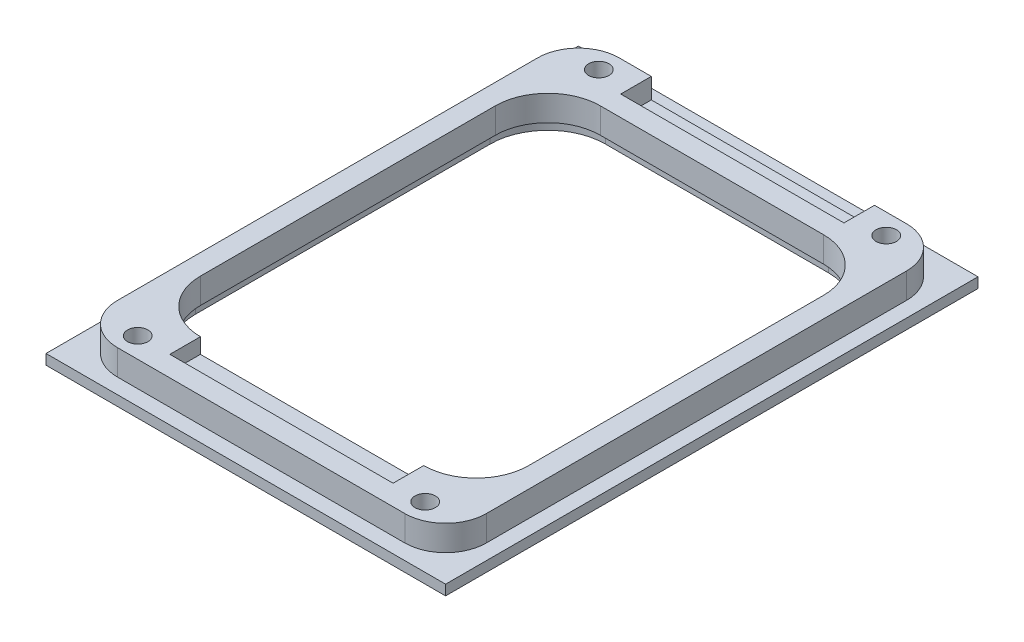
from build123d import *

# Parameters (mm, degrees)
EXTRUDE_1_DEPTH       = 2.5
SKETCH_1_3_W          = 21.9
SKETCH_1_3_H          = 3
EXTRUDE_2_DEPTH       = 0.5
SKETCH_2_R            = 1
CUT_EXTRUDE_1_DEPTH   = 34.660057049
SKETCH_3_W            = 21.9
SKETCH_3_H            = 3
CUT_EXTRUDE_2_DEPTH   = 1.5
SKETCH_4_W            = 39.2
SKETCH_4_H            = 52.23
EXTRUDE_3_DEPTH       = 1
CUT_EXTRUDE_START     = -1
CUT_EXTRUDE_3_DEPTH   = 1
FILLET_1_R            = 4
CUT_EXTRUDE_1_2_DEPTH = 1


with BuildPart() as part:
    # 草图1 → 凸台-拉伸1 (new body)
    with BuildSketch(Plane(origin=(0, 0, 0), x_dir=(1, 0, 0), z_dir=(0, 1, 0))):
        Polygon((20.308319986, -22.503204833), (20.308319986, 26.726795167), (13.158319986, 26.726795167), (13.158319986, 23.726795167), (-8.741680014, 23.726795167), (-8.741680014, 26.726795167), (-15.891680014, 26.726795167), (-15.891680014, -22.503204833), align=None)
        with BuildLine():
            ThreePointArc((18.308319986, -12.353204833), (16.799919909, -15.994804756), (13.158319986, -17.503204833))
            Line((13.158319986, -17.503204833), (-8.741680014, -17.503204833))
            ThreePointArc((-8.741680014, -17.503204833), (-12.383279937, -15.994804756), (-13.891680014, -12.353204833))
            Line((-13.891680014, -12.353204833), (-13.891680014, 16.576795167))
            ThreePointArc((-13.891680014, 16.576795167), (-12.383279937, 20.21839509), (-8.741680014, 21.726795167))
            Line((-8.741680014, 21.726795167), (13.158319986, 21.726795167))
            ThreePointArc((13.158319986, 21.726795167), (16.799919909, 20.21839509), (18.308319986, 16.576795167))
            Line((18.308319986, 16.576795167), (18.308319986, -12.353204833))
        make_face(mode=Mode.SUBTRACT)
    extrude(amount=EXTRUDE_1_DEPTH)

    # 草图1<3> → 凸台-拉伸2 (add)
    with BuildSketch(Plane(origin=(0, 0, 0), x_dir=(1, 0, 0), z_dir=(0, 1, 0))):
        with Locations((2.208319986, 25.226795167)):
            Rectangle(SKETCH_1_3_W, SKETCH_1_3_H)
    extrude(amount=EXTRUDE_2_DEPTH)

    # 草图2 → Cut-Extrude 1 (cut, through all)
    with BuildSketch(Plane.XZ):
        with Locations((-11.891680014, -24.726795167)):
            Circle(SKETCH_2_R)
        with Locations((-11.891680014, 20.503204833)):
            Circle(SKETCH_2_R)
        with Locations((16.308319986, 20.503204833)):
            Circle(SKETCH_2_R)
        with Locations((16.308319986, -24.726795167)):
            Circle(SKETCH_2_R)
    extrude(amount=-CUT_EXTRUDE_1_DEPTH, mode=Mode.SUBTRACT)

    # 草图3 → 切除-拉伸2 (cut)
    with BuildSketch(Plane(origin=(0, 2.5, 0), x_dir=(1, 0, 0), z_dir=(0, 1, 0))):
        with Locations((2.208319986, -19.003204833)):
            Rectangle(SKETCH_3_W, SKETCH_3_H)
    extrude(amount=-CUT_EXTRUDE_2_DEPTH, mode=Mode.SUBTRACT)

    # 草图4 → 凸台-拉伸3 (add)
    with BuildSketch(Plane.XZ):
        with Locations((2.208319986, -2.111795167)):
            Rectangle(SKETCH_4_W, SKETCH_4_H)
    extrude(amount=EXTRUDE_3_DEPTH)

    # 草图5 → 切除-拉伸3 (cut)
    with BuildSketch(Plane(origin=(0, 0, 0), x_dir=(1, 0, 0), z_dir=(0, 1, 0)).offset(CUT_EXTRUDE_START)):
        with BuildLine():
            Line((18.308319986, -12.353204833), (18.308319986, 16.576795167))
            ThreePointArc((18.308319986, 16.576795167), (16.799919909, 20.21839509), (13.158319986, 21.726795167))
            Line((13.158319986, 21.726795167), (-8.741680014, 21.726795167))
            ThreePointArc((-8.741680014, 21.726795167), (-12.383279937, 20.21839509), (-13.891680014, 16.576795167))
            Line((-13.891680014, 16.576795167), (-13.891680014, -12.353204833))
            ThreePointArc((-13.891680014, -12.353204833), (-12.383279937, -15.994804756), (-8.741680014, -17.503204833))
            Line((-8.741680014, -17.503204833), (13.158319986, -17.503204833))
            ThreePointArc((13.158319986, -17.503204833), (16.799919909, -15.994804756), (18.308319986, -12.353204833))
        make_face()
    extrude(amount=CUT_EXTRUDE_3_DEPTH, mode=Mode.SUBTRACT)

    # 圆角1
    fillet_1_edges = [part.edges().sort_by_distance(p)[0] for p in [
        (-15.891680014, 1.25, 22.503204833),
        (-15.891680014, 1.25, -26.726795167),
        (20.308319986, 1.25, -26.726795167),
        (20.308319986, 1.25, 22.503204833),
    ]]
    fillet(fillet_1_edges, radius=FILLET_1_R)

    # 草图5<2> → Cut-Extrude 1 2 (cut)
    with BuildSketch(Plane(origin=(0, 0, 0), x_dir=(1, 0, 0), z_dir=(0, 1, 0)).offset(CUT_EXTRUDE_START)):
        with BuildLine():
            Line((-8.741680014, -18.003204833), (13.158319986, -18.003204833))
            ThreePointArc((13.158319986, -18.003204833), (17.153473299, -16.348358147), (18.808319986, -12.353204833))
            Line((18.808319986, -12.353204833), (18.808319986, 16.576795167))
            ThreePointArc((18.808319986, 16.576795167), (17.153473299, 20.571948481), (13.158319986, 22.226795167))
            Line((13.158319986, 22.226795167), (-8.741680014, 22.226795167))
            ThreePointArc((-8.741680014, 22.226795167), (-12.736833328, 20.571948481), (-14.391680014, 16.576795167))
            Line((-14.391680014, 16.576795167), (-14.391680014, -12.353204833))
            ThreePointArc((-14.391680014, -12.353204833), (-12.736833328, -16.348358147), (-8.741680014, -18.003204833))
        make_face()
        with BuildLine():
            Line((-8.741680014, -17.503204833), (13.158319986, -17.503204833))
            ThreePointArc((13.158319986, -17.503204833), (16.799919909, -15.994804756), (18.308319986, -12.353204833))
            Line((18.308319986, -12.353204833), (18.308319986, 16.576795167))
            ThreePointArc((18.308319986, 16.576795167), (16.799919909, 20.21839509), (13.158319986, 21.726795167))
            Line((13.158319986, 21.726795167), (-8.741680014, 21.726795167))
            ThreePointArc((-8.741680014, 21.726795167), (-12.383279937, 20.21839509), (-13.891680014, 16.576795167))
            Line((-13.891680014, 16.576795167), (-13.891680014, -12.353204833))
            ThreePointArc((-13.891680014, -12.353204833), (-12.383279937, -15.994804756), (-8.741680014, -17.503204833))
        make_face(mode=Mode.SUBTRACT)
    extrude(amount=CUT_EXTRUDE_1_2_DEPTH, mode=Mode.SUBTRACT)


solid = part.part
